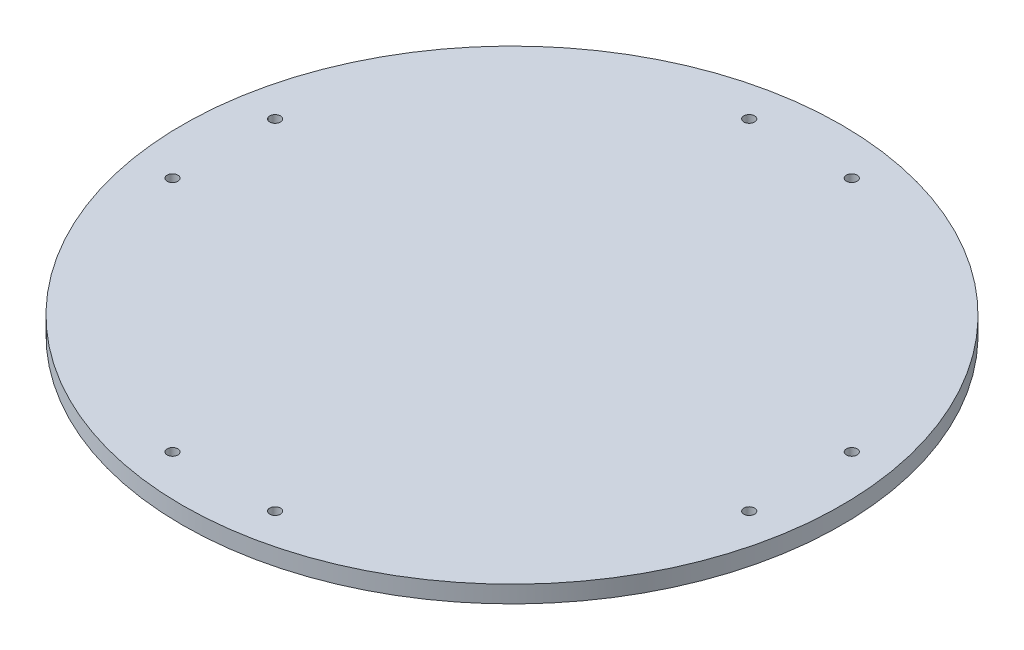
from build123d import *

# Parameters (mm, degrees)
SKETCH1_R           = 122.4
BOSS_EXTRUDE1_DEPTH = 6.35
SKETCH2_R           = 1.9939
CUT_EXTRUDE1_DEPTH  = 174.216172744
CIRPATTERN1_COUNT   = 4


with BuildPart() as part:
    # Sketch1 → Boss-Extrude1 (new body)
    with BuildSketch(Plane(origin=(0, 0, 0), x_dir=(1, 0, 0), z_dir=(0, 1, 0))):
        with Locations(Location((0, 0, 0), (0, 0, 270))):
            Circle(SKETCH1_R)
    extrude(amount=BOSS_EXTRUDE1_DEPTH)

    # Sketch2 → Cut-Extrude1 (cut, through all)
    with BuildSketch(Plane(origin=(0, 6.35, 0), x_dir=(1, 0, 0), z_dir=(0, 1, 0))):
        with Locations(Location((-19.05, -107.035541925, 0), (0, 0, 270))):
            Circle(SKETCH2_R)
        with Locations(Location((19.05, -107.035541925, 0), (0, 0, 270))):
            Circle(SKETCH2_R)
    cut_extrude1 = extrude(amount=-CUT_EXTRUDE1_DEPTH, mode=Mode.SUBTRACT)

    # CirPattern1: Cut-Extrude1 ×4 about axis
    cirpattern1_axis = Axis((0, 0, -0.056837174), (0, 1, 0))
    for i in range(1, CIRPATTERN1_COUNT):
        add(cut_extrude1.rotate(cirpattern1_axis, i * 360 / CIRPATTERN1_COUNT), mode=Mode.SUBTRACT)


solid = part.part
